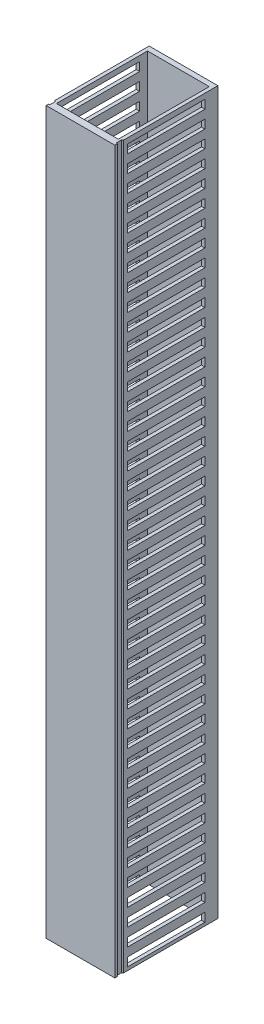
from build123d import *

# Parameters (mm, degrees)
SKETCH1_W           = 40
SKETCH1_H           = 60
BOSS_EXTRUDE1_DEPTH = 420
CUT_EXTRUDE1_DEPTH  = 427.145515053
SKETCH3_W           = 45
SKETCH3_H           = 5
CUT_EXTRUDE2_DEPTH  = 427.145515053
SKETCH4_W           = 36
SKETCH4_H           = 53
CUT_EXTRUDE3_DEPTH  = 427.145515053
LPATTERN1_COUNT     = 42
LPATTERN1_PITCH     = 10


with BuildPart() as part:
    # Sketch1 → Boss-Extrude1 (new body)
    with BuildSketch(Plane(origin=(0, 0, 0), x_dir=(1, 0, 0), z_dir=(0, 1, 0))):
        with Locations((20, 30)):
            Rectangle(SKETCH1_W, SKETCH1_H)
    extrude(amount=BOSS_EXTRUDE1_DEPTH)

    # Sketch2 → Cut-Extrude1 (cut, through all)
    with BuildSketch(Plane.XZ):
        Polygon((-1.684108549, -1.456175345), (0.697832705, -1.456175345), (0.697832705, -4.5643182), (-2.032685317, -6.77197107), align=None)
        Polygon((42.032685317, -6.77197107), (41.684108549, -1.456175345), (39.302167295, -1.456175345), (39.302167295, -4.5643182), align=None)
    extrude(amount=-CUT_EXTRUDE1_DEPTH, mode=Mode.SUBTRACT)

    # Sketch3 → Cut-Extrude2 (cut, through all)
    with BuildSketch(Plane.ZY):
        with Locations((-29.946321538, 414.409519192)):
            Rectangle(SKETCH3_W, SKETCH3_H)
    cut_extrude2 = extrude(amount=-CUT_EXTRUDE2_DEPTH, mode=Mode.SUBTRACT)

    # Sketch4 → Cut-Extrude3 (cut, through all)
    with BuildSketch(Plane(origin=(0, 420, 0), x_dir=(1, 0, 0), z_dir=(0, 1, 0))):
        with Locations((20, 30.5)):
            Rectangle(SKETCH4_W, SKETCH4_H)
    extrude(amount=-CUT_EXTRUDE3_DEPTH, mode=Mode.SUBTRACT)

    # LPattern1: Cut-Extrude2 ×42
    with Locations(*[(0, -i * LPATTERN1_PITCH, 0) for i in range(1, LPATTERN1_COUNT)]):
        add(cut_extrude2, mode=Mode.SUBTRACT)


solid = part.part
